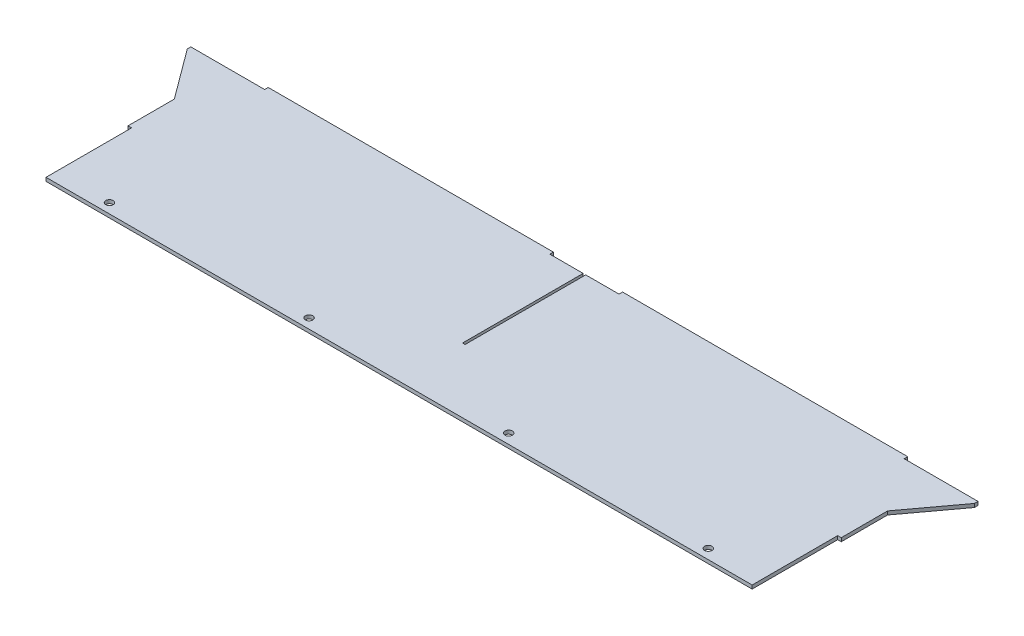
from build123d import *

# Parameters (mm, degrees)
SKETCH1_W            = 635.3556
SKETCH1_H            = 165.1
BOSS_EXTRUDE1_DEPTH  = 1.5875
SKETCH2_W            = 254
SKETCH2_H            = 3.175
BOSS_EXTRUDE2_DEPTH  = 3.175
BOSS_EXTRUDE3_DEPTH  = 3.175
SKETCH5_W            = 1.143
SKETCH5_H            = 107.442
SKETCH5_W_2          = 3.175
SKETCH5_H_2          = 76.2
CUT_EXTRUDE2_DEPTH   = 361.921161502
M6_CLEARANCE_HOLE1_D = 6.6
LPATTERN2_COUNT      = 4
LPATTERN2_PITCH      = 177.8


with BuildPart() as part:
    # Sketch1 → Boss-Extrude1 (new, symmetric)
    with BuildSketch(Plane(origin=(0, 0, 0), x_dir=(1, 0, 0), z_dir=(0, 1, 0))):
        Rectangle(SKETCH1_W, SKETCH1_H)
    extrude(amount=BOSS_EXTRUDE1_DEPTH, both=True)

    # Sketch2 → Boss-Extrude2 (add)
    with BuildSketch(Plane(origin=(0, 0, -82.55), x_dir=(-1, 0, 0), z_dir=(0, 0, -1))):
        with Locations((-157.8229, 0)):
            Rectangle(SKETCH2_W, SKETCH2_H)
        with Locations((157.8229, 0)):
            Rectangle(SKETCH2_W, SKETCH2_H)
    extrude(amount=BOSS_EXTRUDE2_DEPTH)

    # Sketch3 → Boss-Extrude3 (add)
    with BuildSketch(Plane.XZ.offset(1.5875)):
        Polygon((317.6778, -82.55), (350.57842, -82.55), (350.57842, -79.375), (317.6778, -34.925), align=None)
    boss_extrude3 = extrude(amount=-BOSS_EXTRUDE3_DEPTH)

    # Mirror1: Boss-Extrude3 across plane
    add(boss_extrude3.mirror(Plane(origin=(0, 0, 0), x_dir=(0, 0, 1), z_dir=(1, 0, 0))))

    # Sketch5 → Cut-Extrude2 (cut, through all)
    with BuildSketch(Plane.XZ.offset(1.5875)):
        with Locations((0.5715, -28.829)):
            Rectangle(SKETCH5_W, SKETCH5_H)
        with Locations((-0.5715, -28.829)):
            Rectangle(SKETCH5_W, SKETCH5_H)
        with Locations((-316.0903, 44.45)):
            Rectangle(SKETCH5_W_2, SKETCH5_H_2)
        with Locations((316.0903, 44.45)):
            Rectangle(SKETCH5_W_2, SKETCH5_H_2)
    extrude(amount=-CUT_EXTRUDE2_DEPTH, mode=Mode.SUBTRACT)

    # M6 Clearance Hole1 (through all)
    with Locations(Plane(origin=(0, 1.5875, 0), x_dir=(1, 0, 0), z_dir=(0, 1, 0))):
        with Locations((266.7, -73.8124)):
            m6_clearance_hole1 = Hole(M6_CLEARANCE_HOLE1_D / 2)

    # LPattern2: M6 Clearance Hole1 ×4
    with Locations(*[(-i * LPATTERN2_PITCH, 0, 0) for i in range(1, LPATTERN2_COUNT)]):
        add(m6_clearance_hole1, mode=Mode.SUBTRACT)


solid = part.part
